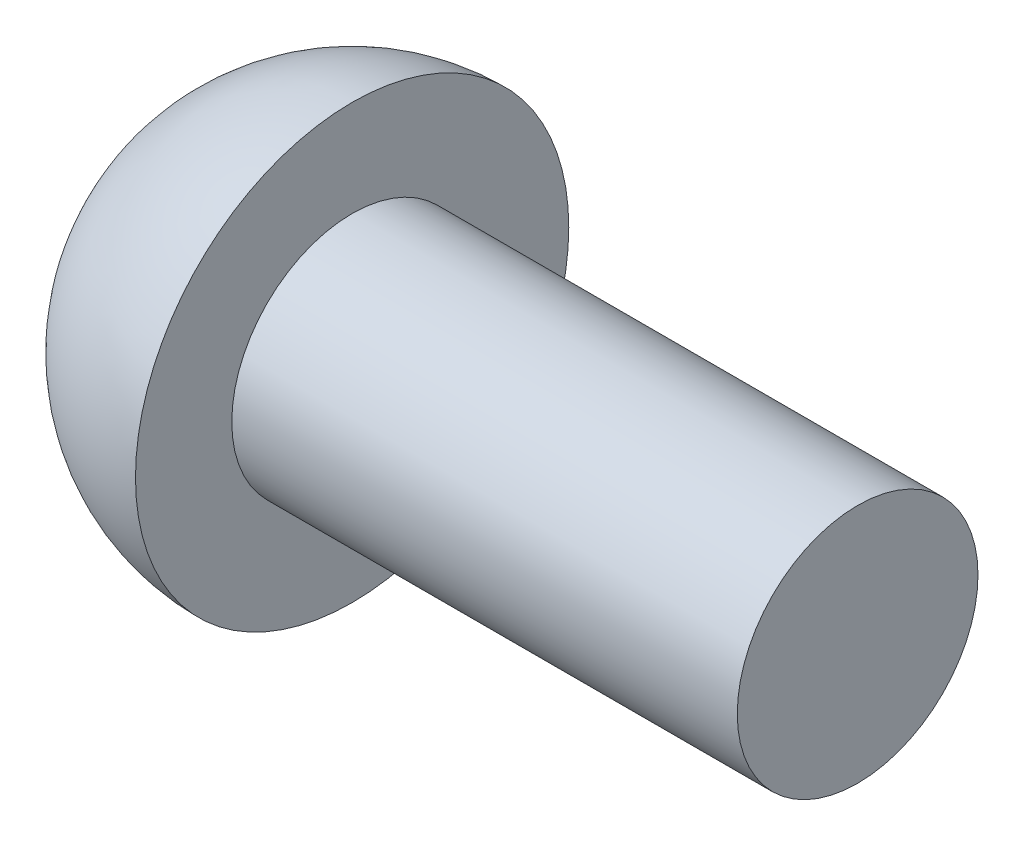
from build123d import *


with BuildPart() as part:
    # Sketch1 → Revolve1 (revolve)
    with BuildSketch(Plane.XY):
        with BuildLine():
            Line((0, 0), (-30, 0))
            ThreePointArc((-30, 0), (-27.363961031, 6.363961031), (-21, 9))
            Line((-21, 9), (-21, 5))
            Line((-21, 5), (0, 5))
            Line((0, 5), (0, 0))
        make_face()
    revolve(axis=Axis((0, 0, 0), (-1, 0, 0)))


solid = part.part
